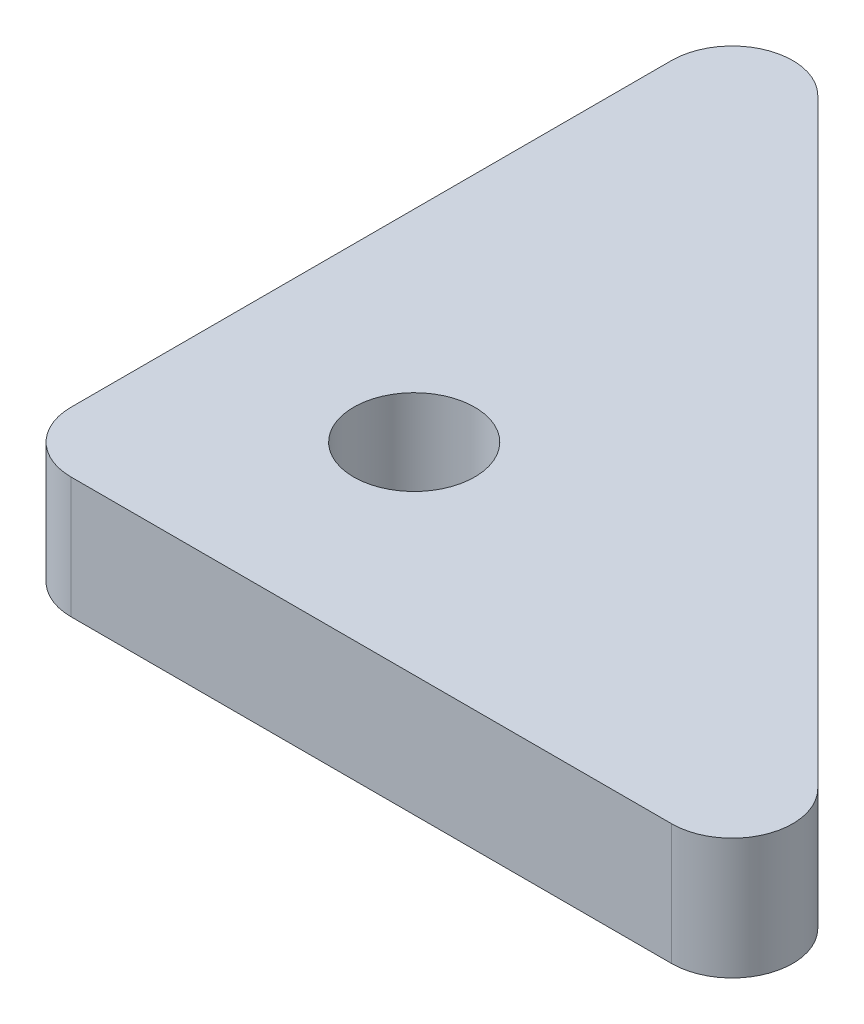
from build123d import *

# Parameters (mm, degrees)
SKETCH1_R           = 3
BOSS_EXTRUDE1_DEPTH = 6


with BuildPart() as part:
    # Sketch1 → Boss-Extrude1 (new body)
    with BuildSketch(Plane(origin=(0, 0, 0), x_dir=(1, 0, 0), z_dir=(0, 1, 0))):
        with BuildLine():
            Line((5.121320344, 34.878679656), (34.878679656, 5.121320344))
            ThreePointArc((34.878679656, 5.121320344), (35.52899791, 1.851949703), (32.757359313, 0))
            Line((32.757359313, 0), (3, 0))
            ThreePointArc((3, 0), (0.878679656, 0.878679656), (0, 3))
            Line((0, 3), (0, 32.757359313))
            ThreePointArc((0, 32.757359313), (1.851949703, 35.52899791), (5.121320344, 34.878679656))
        make_face()
        with Locations(Location((10, 10, 0), (0, 0, 270))):
            Circle(SKETCH1_R, mode=Mode.SUBTRACT)
    extrude(amount=BOSS_EXTRUDE1_DEPTH)


solid = part.part
